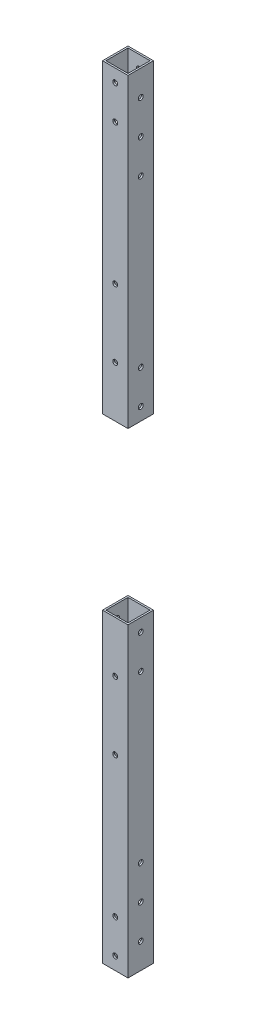
from build123d import *

# Parameters (mm, degrees)
SKETCH_1_W          = 15
SKETCH_1_H          = 15
SKETCH_1_W_2        = 13
SKETCH_1_H_2        = 13
EXTRUDE_1_DEPTH     = 460
SKETCH_2_R          = 1.45
CUT_EXTRUDE_1_DEPTH = 461.305605006
SKETCH_3_R          = 1.45
CUT_EXTRUDE_2_DEPTH = 461.305605006
SKETCH_4_W          = 15
SKETCH_4_H          = 100
CUT_EXTRUDE_3_DEPTH = 461.305605006


with BuildPart() as part:
    # 草图1 → 拉伸-薄壁1 (new body)
    with BuildSketch(Plane(origin=(0, 0, 0), x_dir=(1, 0, 0), z_dir=(0, 1, 0))):
        Rectangle(SKETCH_1_W, SKETCH_1_H)
        Rectangle(SKETCH_1_W_2, SKETCH_1_H_2, mode=Mode.SUBTRACT)
    extrude(amount=EXTRUDE_1_DEPTH)

    # 草图2 → 切除-拉伸1 (cut, through all)
    with BuildSketch(Plane.XY.offset(7.5)):
        with Locations((0, 7.5)):
            Circle(SKETCH_2_R)
        with Locations((0, 27.5)):
            Circle(SKETCH_2_R)
        with Locations(Location((0, 432.5, 0), (0, 0, 180))):
            Circle(SKETCH_2_R)
        with Locations(Location((0, 452.5, 0), (0, 0, 180))):
            Circle(SKETCH_2_R)
        with Locations((0, 310)):
            Circle(SKETCH_2_R)
        with Locations((0, 350)):
            Circle(SKETCH_2_R)
        with Locations(Location((0, 110, 0), (0, 0, 180))):
            Circle(SKETCH_2_R)
        with Locations(Location((0, 150, 0), (0, 0, 180))):
            Circle(SKETCH_2_R)
    extrude(amount=-CUT_EXTRUDE_1_DEPTH, mode=Mode.SUBTRACT)

    # 草图3 → 切除-拉伸2 (cut, through all)
    with BuildSketch(Plane(origin=(7.5, 0, 0), x_dir=(0, 0, -1), z_dir=(1, 0, 0))):
        with Locations((0, 15)):
            Circle(SKETCH_3_R)
        with Locations((0, 35)):
            Circle(SKETCH_3_R)
        with Locations((0, 425)):
            Circle(SKETCH_3_R)
        with Locations((0, 445)):
            Circle(SKETCH_3_R)
        with Locations((0, 172.5)):
            Circle(SKETCH_3_R)
        with Locations((0, 192.5)):
            Circle(SKETCH_3_R)
        with Locations((0, 152.5)):
            Circle(SKETCH_3_R)
        with Locations((0, 307.5)):
            Circle(SKETCH_3_R)
        with Locations((0, 267.5)):
            Circle(SKETCH_3_R)
        with Locations((0, 287.5)):
            Circle(SKETCH_3_R)
        with Locations((0, 55)):
            Circle(SKETCH_3_R)
        with Locations((0, 405)):
            Circle(SKETCH_3_R)
    extrude(amount=-CUT_EXTRUDE_2_DEPTH, mode=Mode.SUBTRACT)

    # 草图4 → 切除-拉伸3 (cut, through all)
    with BuildSketch(Plane(origin=(7.5, 0, 0), x_dir=(0, 0, -1), z_dir=(1, 0, 0))):
        with Locations((0, 230)):
            Rectangle(SKETCH_4_W, SKETCH_4_H)
    extrude(amount=-CUT_EXTRUDE_3_DEPTH, mode=Mode.SUBTRACT)


with BuildPart() as cut_extrude_3_piece_1:
    # of the separate pieces the step leaves, piece 1, a body of its own (cut_extrude_3_pieces)
    add(part.part.solids().sort_by_distance((7.5, 280, -7.5))[0])


with BuildPart() as cut_extrude_3_piece_2:
    # of the separate pieces the step leaves, piece 2, a body of its own (cut_extrude_3_pieces)
    add(part.part.solids().sort_by_distance((7.5, 0, -7.5))[0])


solid = Compound([cut_extrude_3_piece_1.part, cut_extrude_3_piece_2.part])
